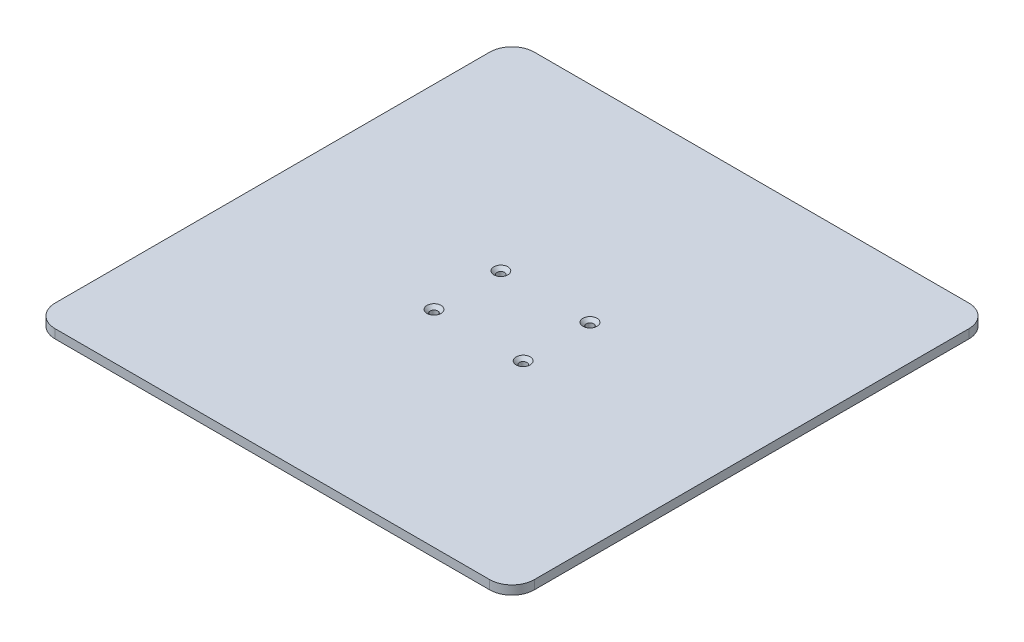
from build123d import *

# Parameters (mm, degrees)
SKETCH1_W                                       = 215
SKETCH1_H                                       = 215
BOSS_EXTRUDE1_DEPTH                             = 2
CSK_FOR_M3_FLAT_HEAD_MACHINE_SCREW1_D           = 3.4
CSK_FOR_M3_FLAT_HEAD_MACHINE_SCREW1_CSINK_D     = 6.3
CSK_FOR_M3_FLAT_HEAD_MACHINE_SCREW1_CSINK_ANGLE = 90
FILLET1_R                                       = 10


with BuildPart() as part:
    # Sketch1 → Boss-Extrude1 (new, symmetric)
    with BuildSketch(Plane(origin=(0, 0, 0), x_dir=(1, 0, 0), z_dir=(0, 1, 0))):
        Rectangle(SKETCH1_W, SKETCH1_H)
    extrude(amount=BOSS_EXTRUDE1_DEPTH, both=True)

    # CSK for M3 Flat Head Machine Screw1 (through all)
    with Locations(Plane(origin=(0, 2, 0), x_dir=(1, 0, 0), z_dir=(0, 1, 0))):
        with Locations((-20, 15), (20, 15), (20, -15), (-20, -15)):
            CounterSinkHole(CSK_FOR_M3_FLAT_HEAD_MACHINE_SCREW1_D / 2, CSK_FOR_M3_FLAT_HEAD_MACHINE_SCREW1_CSINK_D / 2, counter_sink_angle=CSK_FOR_M3_FLAT_HEAD_MACHINE_SCREW1_CSINK_ANGLE)

    # Fillet1
    fillet1_edges = [part.edges().sort_by_distance(p)[0] for p in [
        (107.5, 0, 107.5),
        (-107.5, 0, 107.5),
        (-107.5, 0, -107.5),
        (107.5, 0, -107.5),
    ]]
    fillet(fillet1_edges, radius=FILLET1_R)


solid = part.part
